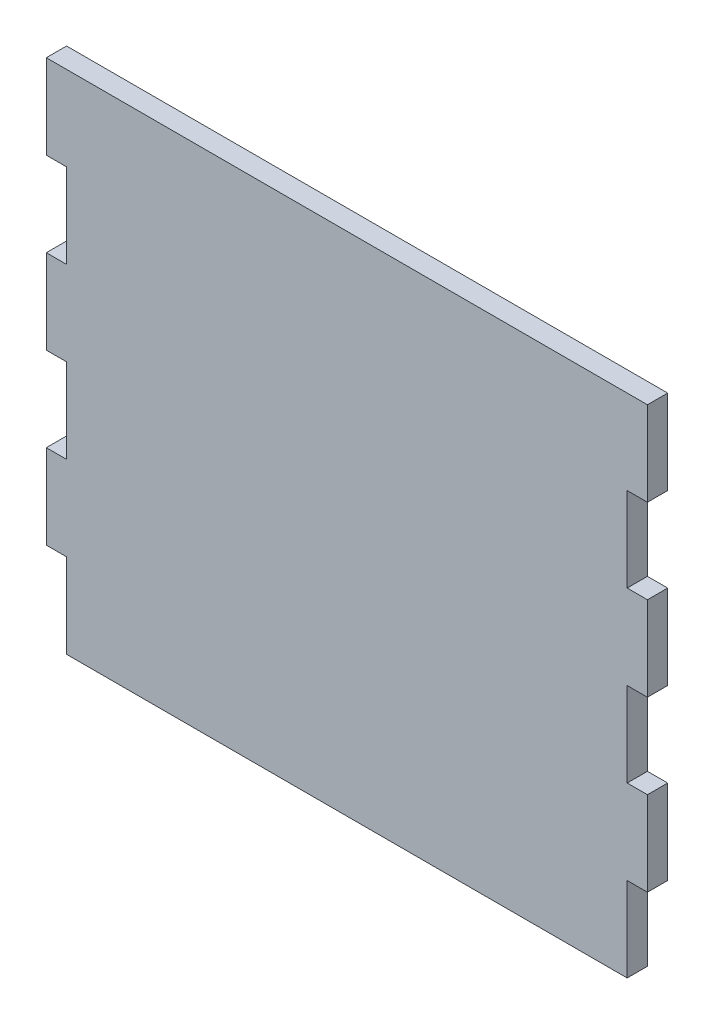
from build123d import *

# Parameters (mm, degrees)
SKETCH1_W            = 178
SKETCH1_H            = 150
BOSS_EXTRUDE1_DEPTH  = 6
SKETCH2_W            = 6
SKETCH2_H            = 25
CUT_EXTRUDE1_DEPTH   = 6
LPATTERN1_COUNT      = 3
LPATTERN1_PITCH      = 50
LPATTERN1_COUNT_DIR2 = 2
LPATTERN1_PITCH_DIR2 = 172


with BuildPart() as part:
    # Sketch1 → Boss-Extrude1 (new body)
    with BuildSketch(Plane.XY):
        with Locations((-89, 75)):
            Rectangle(SKETCH1_W, SKETCH1_H)
    extrude(amount=BOSS_EXTRUDE1_DEPTH)

    # Sketch2 → Cut-Extrude1 (cut)
    with BuildSketch(Plane.XY.offset(6)):
        with Locations((-175, 112.5)):
            Rectangle(SKETCH2_W, SKETCH2_H)
    cut_extrude1 = extrude(amount=-CUT_EXTRUDE1_DEPTH, mode=Mode.SUBTRACT)

    # LPattern1: Cut-Extrude1 3 × 2
    with Locations(*[(j * LPATTERN1_PITCH_DIR2, -i * LPATTERN1_PITCH, 0) for i in range(LPATTERN1_COUNT) for j in range(LPATTERN1_COUNT_DIR2) if (i, j) != (0, 0)]):
        add(cut_extrude1, mode=Mode.SUBTRACT)


solid = part.part
